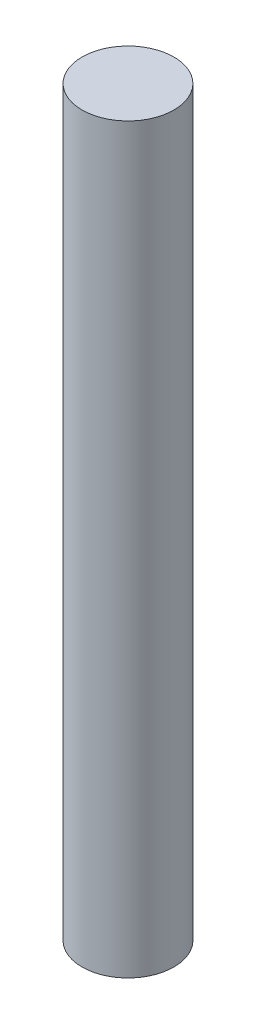
from build123d import *

# Parameters (mm, degrees)
SKETCH1_R           = 6.2865
BOSS_EXTRUDE1_DEPTH = 101.6


with BuildPart() as part:
    # Sketch1 → Boss-Extrude1 (new body)
    with BuildSketch(Plane(origin=(0, 0, 0), x_dir=(1, 0, 0), z_dir=(0, 1, 0))):
        with Locations(Location((0, 0, 0), (0, 0, 270))):
            Circle(SKETCH1_R)
    extrude(amount=BOSS_EXTRUDE1_DEPTH)


solid = part.part
